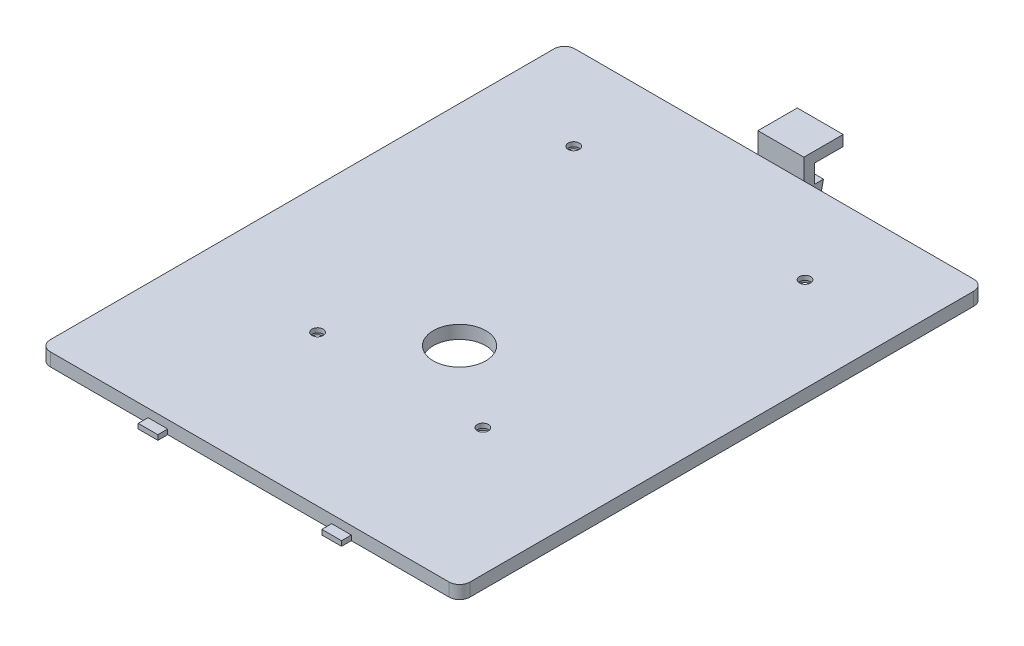
from build123d import *

# Parameters (mm, degrees)
SKETCH1_W                                          = 101.6
SKETCH1_H                                          = 127
BOSS_EXTRUDE1_DEPTH                                = 3.175
SKETCH2_W                                          = 4.7625
SKETCH2_H                                          = 2.38125
BOSS_EXTRUDE2_DEPTH                                = 1.190625
FILLET1_R                                          = 2.54
BOSS_EXTRUDE3_DEPTH                                = 5.55625
CBORE_FOR_M2_5_HEX_HEAD_MACHINE_SCREW1_D           = 2.7
CBORE_FOR_M2_5_HEX_HEAD_MACHINE_SCREW1_CBORE_D     = 7.28
CBORE_FOR_M2_5_HEX_HEAD_MACHINE_SCREW1_CBORE_DEPTH = 2.1
SKETCH8_R                                          = 6.35
CUT_EXTRUDE1_DEPTH                                 = 148.63326429


with BuildPart() as part:
    # Sketch1 → Boss-Extrude1 (new body)
    with BuildSketch(Plane(origin=(0, 0, 0), x_dir=(1, 0, 0), z_dir=(0, 1, 0))):
        with Locations((0, 63.5)):
            Rectangle(SKETCH1_W, SKETCH1_H)
    extrude(amount=BOSS_EXTRUDE1_DEPTH)

    # Sketch2 → Boss-Extrude2 (add)
    with BuildSketch(Plane.XZ):
        with Locations((-22.225, 1.190625)):
            Rectangle(SKETCH2_W, SKETCH2_H)
        with Locations((22.225, 1.190625)):
            Rectangle(SKETCH2_W, SKETCH2_H)
    extrude(amount=-BOSS_EXTRUDE2_DEPTH)

    # Fillet1
    fillet1_edges = [part.edges().sort_by_distance(p)[0] for p in [
        (50.8, 1.5875, 0),
        (-50.8, 1.5875, 0),
        (-50.8, 1.5875, -127),
        (50.8, 1.5875, -127),
    ]]
    fillet(fillet1_edges, radius=FILLET1_R)

    # Sketch4 → Boss-Extrude3 (add, symmetric)
    with BuildSketch(Plane(origin=(0, 0, 0), x_dir=(0, 0, -1), z_dir=(1, 0, 0))):
        with BuildLine():
            Line((120.65, 0), (126.111050725, -5.461050725))
            ThreePointArc((126.111050725, -5.461050725), (128.301155995, -6.024193053), (129.850888229, -4.377371758))
            Line((129.850888229, -4.377371758), (130.175, -2.936875))
            Line((130.175, -2.936875), (128.5875, -2.936875))
            Line((128.5875, -2.936875), (128.5875, 6.588125))
            Line((128.5875, 6.588125), (138.1125, 6.588125))
            Line((138.1125, 6.588125), (138.1125, 4.048125))
            Line((138.1125, 4.048125), (131.1275, 4.048125))
            Line((131.1275, 4.048125), (131.1275, -0.396875))
            Line((131.1275, -0.396875), (133.35, -0.396875))
            Line((133.35, -0.396875), (132.32893701, -4.934932733))
            ThreePointArc((132.32893701, -4.934932733), (129.008082223, -8.463835508), (124.314999501, -7.25710195))
            Line((124.314999501, -7.25710195), (117.057897552, 0))
            Line((117.057897552, 0), (120.65, 0))
        make_face()
    extrude(amount=BOSS_EXTRUDE3_DEPTH, both=True)

    # CBORE for M2.5 Hex Head Machine Screw1 (through all)
    with Locations(Plane(origin=(0, 0, 0), x_dir=(-1, 0, 0), z_dir=(0, -1, 0))):
        with Locations((20, 36.435847812), (28, 106.435847812), (-20, 36.435847812), (-28, 106.435847812)):
            CounterBoreHole(CBORE_FOR_M2_5_HEX_HEAD_MACHINE_SCREW1_D / 2, CBORE_FOR_M2_5_HEX_HEAD_MACHINE_SCREW1_CBORE_D / 2, CBORE_FOR_M2_5_HEX_HEAD_MACHINE_SCREW1_CBORE_DEPTH)

    # Sketch8 → Cut-Extrude1 (cut, through all)
    with BuildSketch(Plane(origin=(0, 3.175, 0), x_dir=(1, 0, 0), z_dir=(0, 1, 0))):
        with Locations(Location((0, 50.8, 0), (0, 0, 270))):
            Circle(SKETCH8_R)
    extrude(amount=-CUT_EXTRUDE1_DEPTH, mode=Mode.SUBTRACT)


solid = part.part
